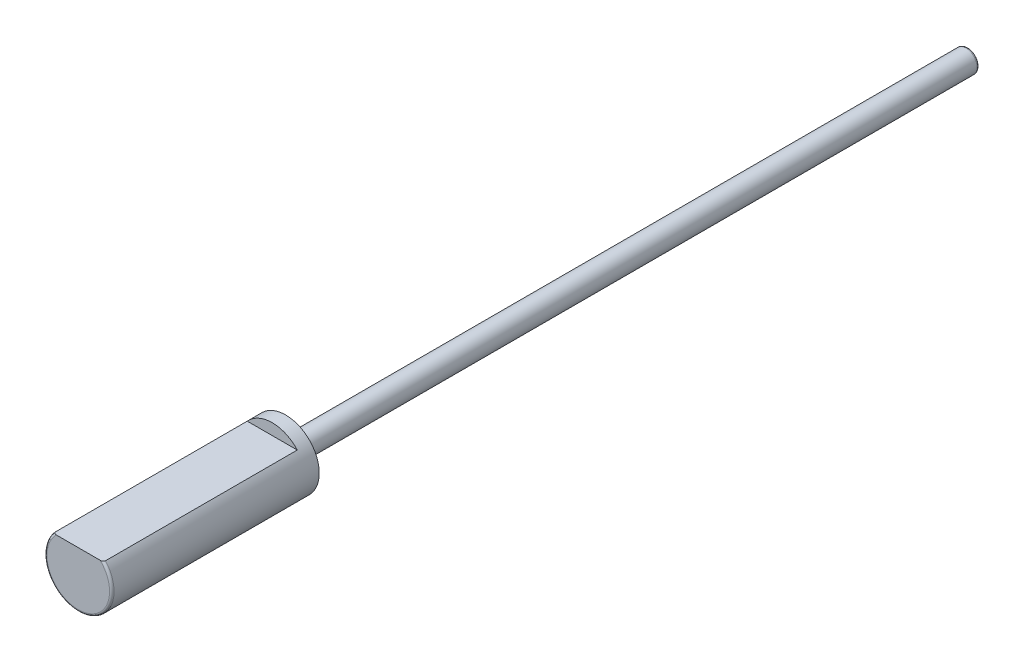
from build123d import *

# Parameters (mm, degrees)
SKETCH1_R           = 1.5
BOSS_EXTRUDE1_DEPTH = 9.27
CUT_EXTRUDE1_DEPTH  = 8.67
SKETCH3_R           = 0.5
BOSS_EXTRUDE2_DEPTH = 30.5
FILLET1_R           = 0.1


with BuildPart() as part:
    # Sketch1 → Boss-Extrude1 (new body)
    with BuildSketch(Plane.XY):
        Circle(SKETCH1_R)
    extrude(amount=-BOSS_EXTRUDE1_DEPTH)

    # Sketch2 → Cut-Extrude1 (cut)
    with BuildSketch(Plane.XY):
        with BuildLine():
            Line((-1.118033989, 1), (1.118033989, 1))
            ThreePointArc((1.118033989, 1), (0, 1.5), (-1.118033989, 1))
        make_face()
    extrude(amount=-CUT_EXTRUDE1_DEPTH, mode=Mode.SUBTRACT)

    # Sketch3 → Boss-Extrude2 (add)
    with BuildSketch(Plane(origin=(0, 0, -9.27), x_dir=(-1, 0, 0), z_dir=(0, 0, -1))):
        with Locations(Location((0, 0, 0), (0, 0, 180))):
            Circle(SKETCH3_R)
    extrude(amount=BOSS_EXTRUDE2_DEPTH)

    # Fillet1
    fillet1_edges = [part.edges().sort_by_distance(p)[0] for p in [
        (-0.5, 0, -39.77),
        (-0.535233135, -1.401258538, 0),
    ]]
    fillet(fillet1_edges, radius=FILLET1_R)


solid = part.part
